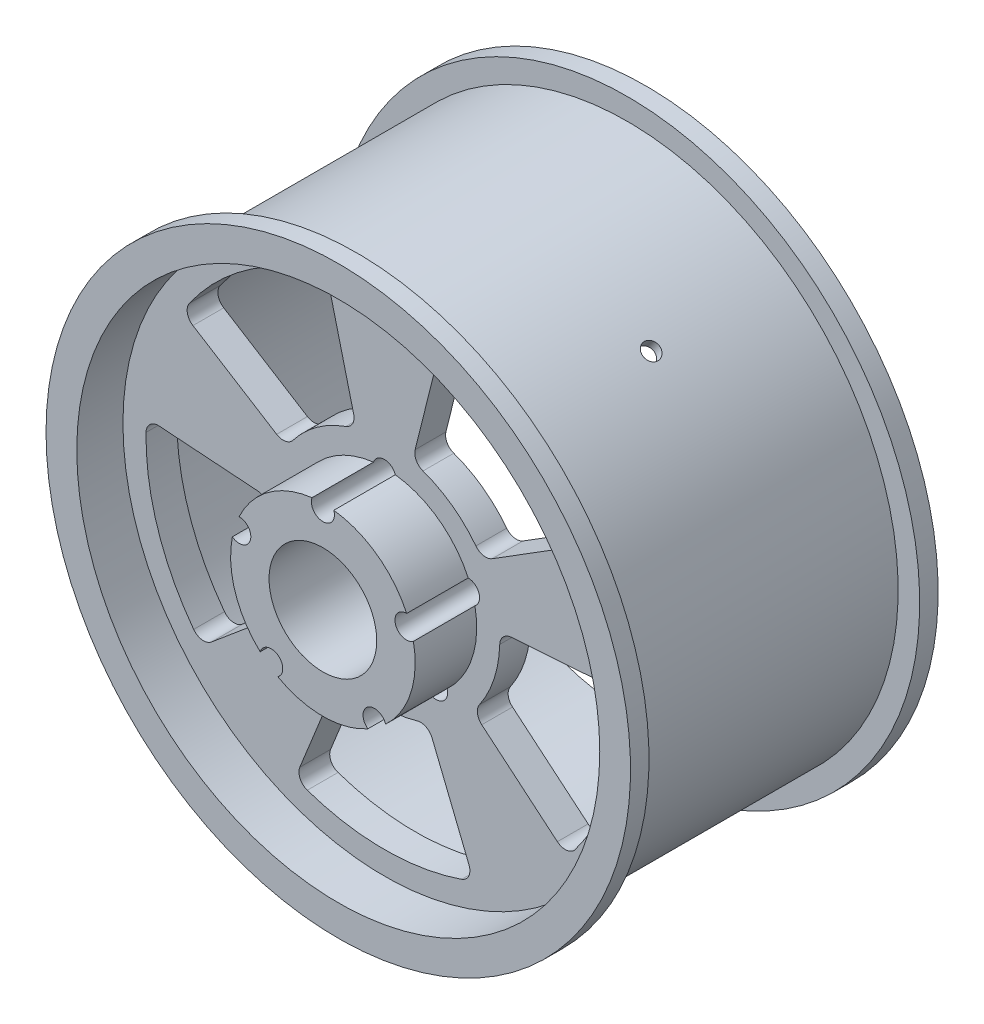
from build123d import *

# Parameters (mm, degrees)
SKETCH_3_R               = 7.5
CUT_EXTRUDE_1_DEPTH      = 342.0278581
SKETCH_4_R               = 35
CUT_EXTRUDE_2_DEPTH      = 342.0278581
SWEEP_2_PROFILE_R        = 5.5
CUT_EXTRUDE_4_DEPTH      = 20
PATTERN_CIRCULAR_2_COUNT = 5


with BuildPart() as part:
    # 草图1 → 旋转1 (revolve)
    with BuildSketch(Plane(origin=(0, 0, 0), x_dir=(1, 0, 0), z_dir=(0, 1, 0))):
        Polygon((170, 0), (190, 0), (190, -12), (176, -12), (176, -188), (190, -188), (190, -200), (170, -200), align=None)
    revolve(axis=Axis((0, 0, 0), (0, 0, 1)))

    # 草图2 → 旋转2 (revolve)
    with BuildSketch(Plane(origin=(0, 0, 0), x_dir=(1, 0, 0), z_dir=(0, 1, 0))):
        Polygon((0, -140), (60, -140), (60, -150), (171, -150), (171, -170), (60, -170), (60, -210), (0, -210), align=None)
    revolve(axis=Axis((0, 0, 140), (0, 0, 1)))

    # 草图3 → 切除-拉伸1 (cut, through all)
    with BuildSketch(Plane.XY.offset(210)):
        with Locations((0, 57.15)):
            Circle(SKETCH_3_R)
        with Locations((-54.35288, 17.660321)):
            Circle(SKETCH_3_R)
        with Locations((-33.591927, -46.235321)):
            Circle(SKETCH_3_R)
        with Locations((33.591927, -46.235321)):
            Circle(SKETCH_3_R)
        with Locations((54.35288, 17.660321)):
            Circle(SKETCH_3_R)
    extrude(amount=-CUT_EXTRUDE_1_DEPTH, mode=Mode.SUBTRACT)

    # 草图4 → 切除-拉伸2 (cut, through all)
    with BuildSketch(Plane.XY.offset(210)):
        Circle(SKETCH_4_R)
    extrude(amount=-CUT_EXTRUDE_2_DEPTH, mode=Mode.SUBTRACT)

    # 切除-扫描2: sweep along a curve in space
    with BuildLine() as sweep_2_path:
        Line((94.046, 129.443, 100), (124.876, 171.912, 100))
    # 切除-扫描2 profile (on start of the path) → 切除-扫描2 (sweep, cut)
    with BuildSketch(Plane(origin=(94.046, 129.443, 100), x_dir=(0.8092483062128621, -0.5874667470517917, 0), z_dir=(0.5874667470517917, 0.8092483062128621, 0))):
        Circle(SWEEP_2_PROFILE_R)
    sweep(path=sweep_2_path.line, mode=Mode.SUBTRACT)

    # 草图13 → 切除-拉伸4 (cut)
    with BuildSketch(Plane.XY.offset(150)):
        with BuildLine():
            Line((19.985, 80.154), (35.509, 142.42))
            ThreePointArc((35.509, 142.42), (39.332805709, 147.47355651), (45.634, 148.148))
            ThreePointArc((45.634, 148.148), (91.104811943, 125.399590257), (126.78, 89.173))
            ThreePointArc((126.78, 89.173), (128.075469778, 82.982322033), (124.477, 77.781))
            Line((124.477, 77.781), (70.055, 43.775))
            ThreePointArc((70.055, 43.775), (64.394250952, 42.695581589), (59.473, 45.694))
            ThreePointArc((59.473, 45.694), (44.083519984, 60.676348797), (25.08, 70.685))
            ThreePointArc((25.08, 70.685), (20.709688829, 74.438697073), (19.985, 80.154))
        make_face()
    cut_extrude_4 = extrude(amount=CUT_EXTRUDE_4_DEPTH, mode=Mode.SUBTRACT)

    # 阵列(圆周)2: 切除-拉伸4 ×5 about axis
    pattern_circular_2_axis = Axis((0, 0, 220.5), (0, 0, -1))
    for i in range(1, PATTERN_CIRCULAR_2_COUNT):
        add(cut_extrude_4.rotate(pattern_circular_2_axis, i * 360 / PATTERN_CIRCULAR_2_COUNT), mode=Mode.SUBTRACT)


solid = part.part
